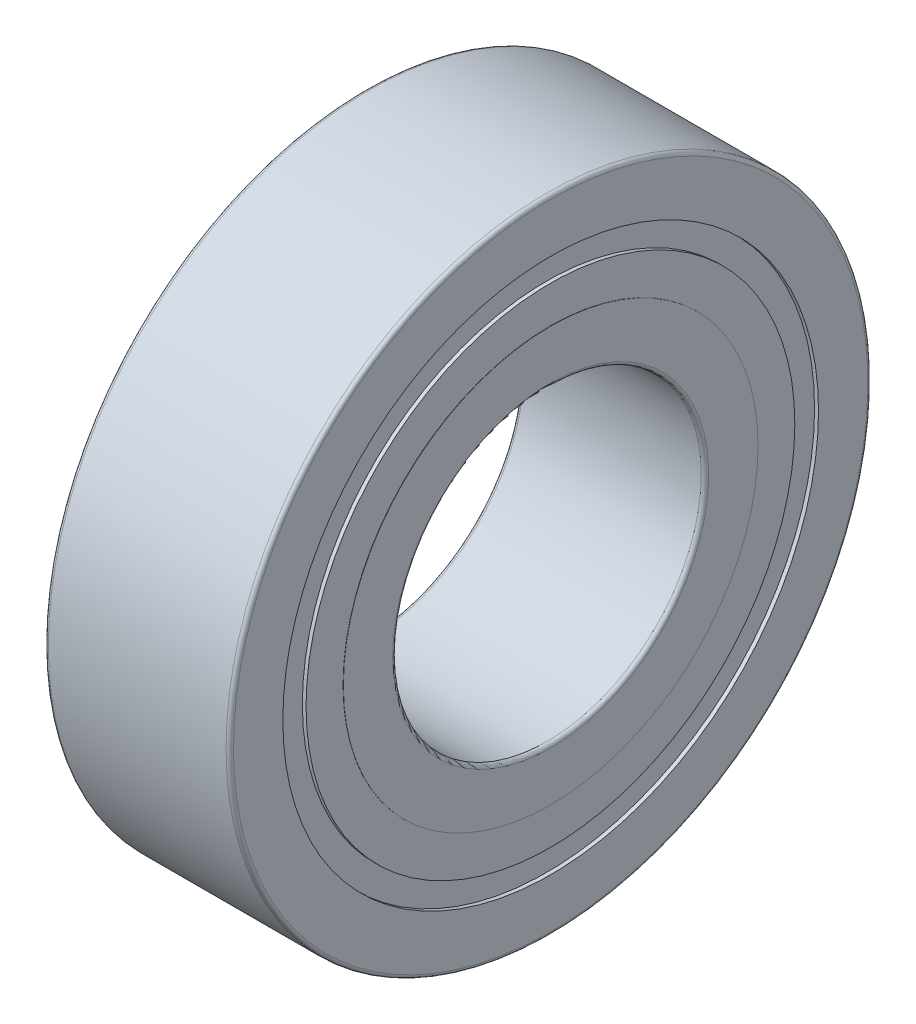
from build123d import *


with BuildPart() as part:
    # Sketch1 → Revolve1 (revolve)
    with BuildSketch(Plane.XY, mode=Mode.PRIVATE) as revolve1_sk:
        with BuildLine():
            Line((-7.2, 12.5), (7.2, 12.5))
            ThreePointArc((7.2, 12.5), (7.412132034, 12.587867966), (7.5, 12.8))
            Line((7.5, 12.8), (7.5, 25.7))
            ThreePointArc((7.5, 25.7), (7.412132034, 25.912132034), (7.2, 26))
            Line((7.2, 26), (-7.2, 26))
            ThreePointArc((-7.2, 26), (-7.412132034, 25.912132034), (-7.5, 25.7))
            Line((-7.5, 25.7), (-7.5, 12.8))
            ThreePointArc((-7.5, 12.8), (-7.412132034, 12.587867966), (-7.2, 12.5))
        make_face()
    revolve(revolve1_sk.sketch.rotate(Axis((50, 0, 0), (-1, 0, 0)), 270), axis=Axis((50, 0, 0), (-1, 0, 0)))

    # Sketch2 → Cut-Revolve1 (revolve, cut)
    with BuildSketch(Plane.XY, mode=Mode.PRIVATE) as cut_revolve1_sk:
        Polygon((-9.18, 21.7), (-9.18, 12.5), (-7.5, 12.5), (-7.5, 16.8), (-7.48, 16.8), (-7.48, 19.8), (-7.18, 19.8), (-7.18, 21.7), align=None)
    revolve(cut_revolve1_sk.sketch.rotate(Axis((50, 0, 0), (-1, 0, 0)), 270), axis=Axis((50, 0, 0), (-1, 0, 0)), mode=Mode.SUBTRACT)

    # Sketch3 → Cut-Revolve2 (revolve, cut)
    with BuildSketch(Plane.XY, mode=Mode.PRIVATE) as cut_revolve2_sk:
        Polygon((7.18, 19.8), (7.48, 19.8), (7.48, 16.8), (7.5, 16.8), (7.5, 12.5), (9.18, 12.5), (9.18, 21.7), (7.18, 21.7), align=None)
    revolve(cut_revolve2_sk.sketch.rotate(Axis((50, 0, 0), (-1, 0, 0)), 270), axis=Axis((50, 0, 0), (-1, 0, 0)), mode=Mode.SUBTRACT)


solid = part.part
